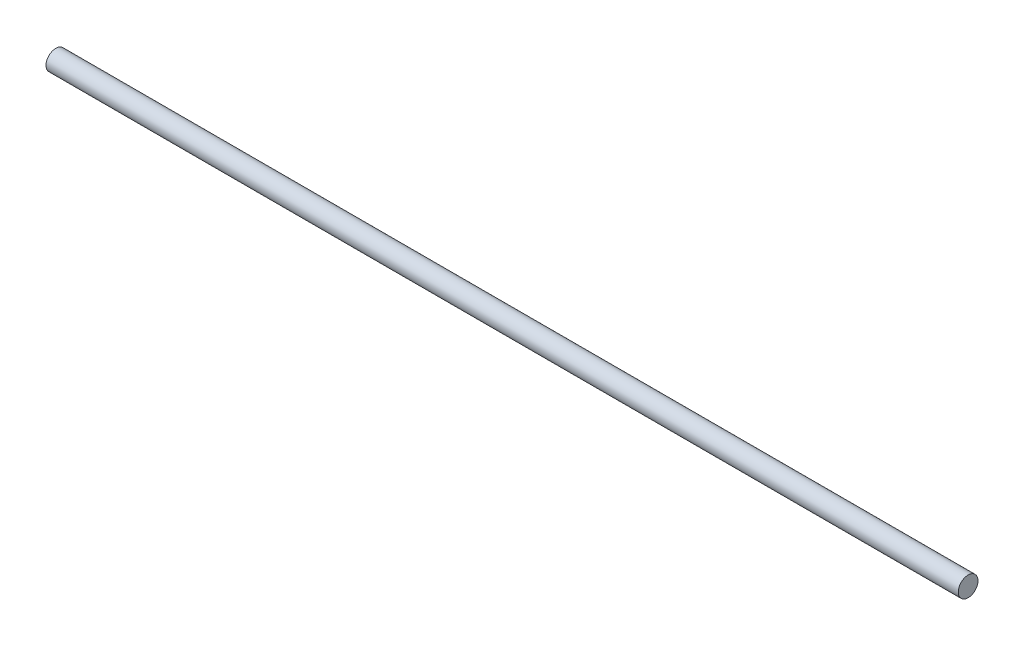
from build123d import *

# Parameters (mm, degrees)
CROQUIS1_R              = 4
SALIENTE_EXTRUIR1_DEPTH = 370


with BuildPart() as part:
    # Croquis1 → Saliente-Extruir1 (new body)
    with BuildSketch(Plane(origin=(0, 0, 0), x_dir=(0, 0, -1), z_dir=(1, 0, 0))):
        Circle(CROQUIS1_R)
    extrude(amount=SALIENTE_EXTRUIR1_DEPTH)


solid = part.part
